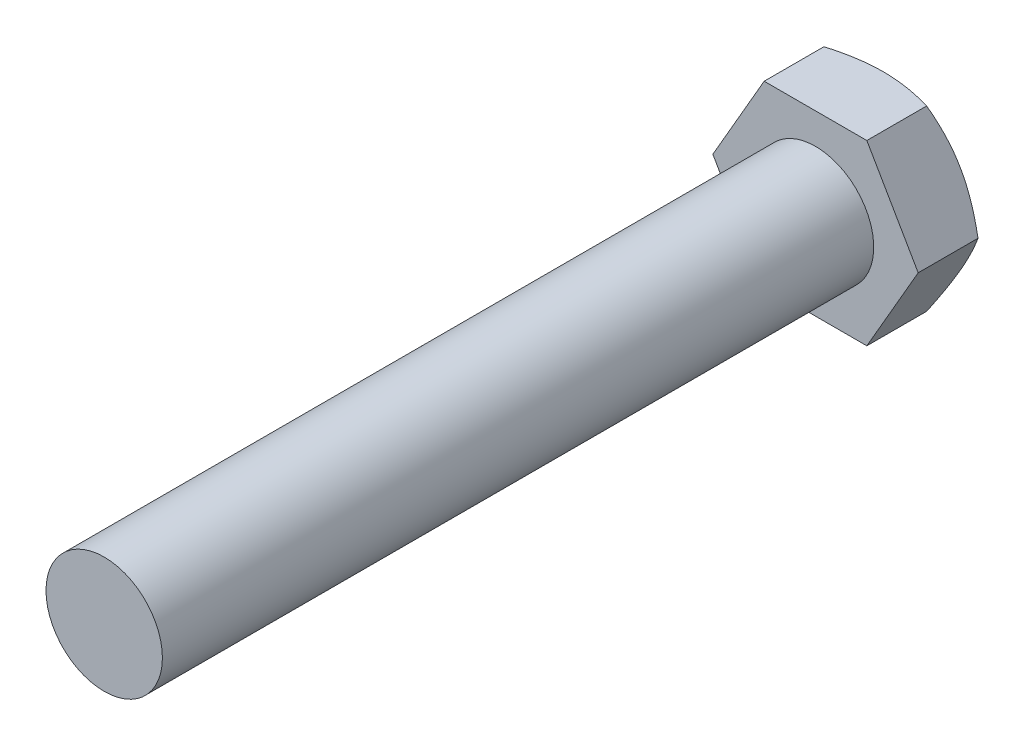
from build123d import *

# Parameters (mm, degrees)
EXTRUDE_1_DEPTH = 22.5
SKETCH_2_R      = 18
EXTRUDE_2_DEPTH = 220


with BuildPart() as part:
    # 草图1 → 拉伸1 (new body)
    with BuildSketch(Plane.XY):
        Polygon((31.754264805, 0), (15.877132403, 27.5), (-15.877132403, 27.5), (-31.754264805, 0), (-15.877132403, -27.5), (15.877132403, -27.5), align=None)
    extrude(amount=EXTRUDE_1_DEPTH)

    # 草图2 → 拉伸2 (add)
    with BuildSketch(Plane.XY.offset(22.5)):
        Circle(SKETCH_2_R)
    extrude(amount=EXTRUDE_2_DEPTH)

    # 草图3 → 切除-旋转1 (revolve, cut)
    with BuildSketch(Plane(origin=(0, 0, 0), x_dir=(1, 0, 0), z_dir=(0, 1, 0))):
        Polygon((31.754264805, -4), (4.6012476, 11.676801793), (47.244906426, 19.875201242), align=None)
    revolve(axis=Axis((0, 0, -27.609458248), (0, 0, 1)), mode=Mode.SUBTRACT)


solid = part.part
